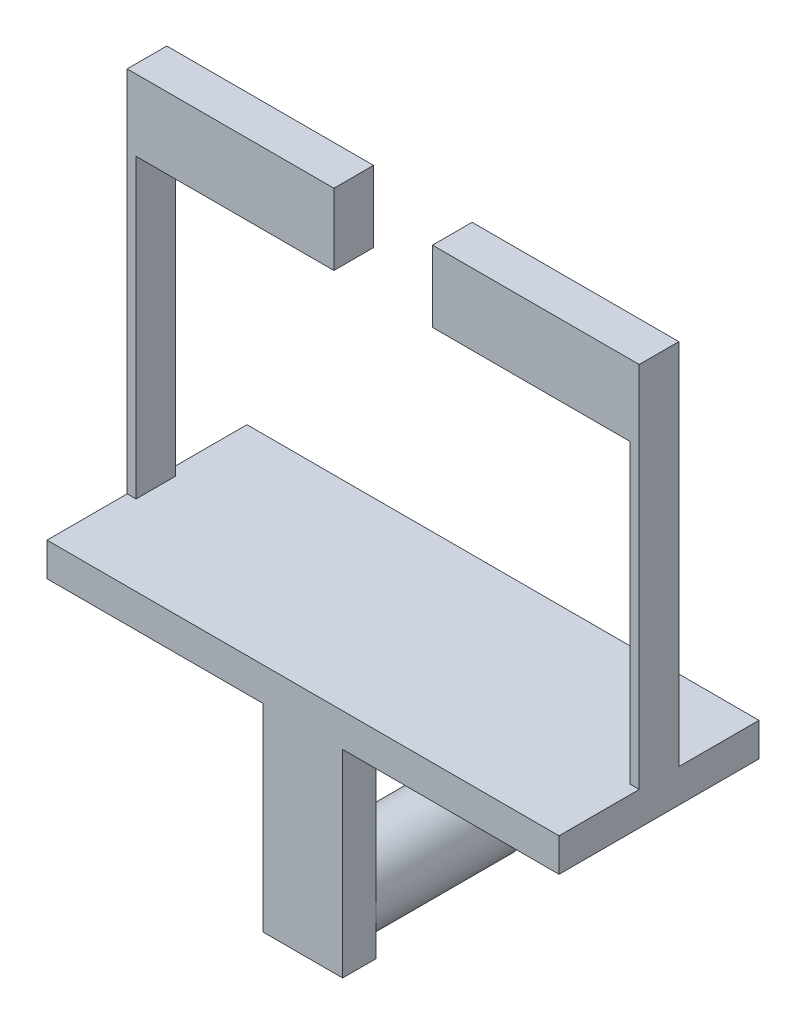
from build123d import *

# Parameters (mm, degrees)
SKETCH6_W            = 10.1981
SKETCH6_H            = 4.28752
BOSS_EXTRUDE3_DEPTH  = 25.4
SKETCH8_R            = 5.09905
BOSS_EXTRUDE5_DEPTH  = 19.05
SKETCH11_W           = 65.69456
SKETCH11_H           = 25.654
BOSS_EXTRUDE10_DEPTH = 4.28752
SKETCH16_W           = 1.143
SKETCH16_H           = 5.08
SKETCH16_W_2         = 1.155076163
BOSS_EXTRUDE11_DEPTH = 38.0746
SKETCH17_W           = 26.52268
SKETCH17_H           = 5.08
BOSS_EXTRUDE12_DEPTH = 9.144


with BuildPart() as part:
    # Sketch6 → Boss-Extrude3 (new body)
    with BuildSketch(Plane(origin=(0, 0, 0), x_dir=(1, 0, 0), z_dir=(0, 1, 0))):
        with Locations((-12.169797761, 9.77580804)):
            Rectangle(SKETCH6_W, SKETCH6_H)
    extrude(amount=BOSS_EXTRUDE3_DEPTH)

    # Sketch8 → Boss-Extrude5 (add)
    with BuildSketch(Plane.XY.offset(-11.91956804)):
        with Locations((-12.169797761, 5.098542)):
            Circle(SKETCH8_R)
    extrude(amount=-BOSS_EXTRUDE5_DEPTH)

    # Sketch11 → Boss-Extrude10 (add)
    with BuildSketch(Plane(origin=(0, 25.4, 0), x_dir=(1, 0, 0), z_dir=(0, 1, 0))):
        with Locations((-12.150747761, 20.45904804)):
            Rectangle(SKETCH11_W, SKETCH11_H)
    extrude(amount=BOSS_EXTRUDE10_DEPTH)

    # Sketch16 → Boss-Extrude11 (add)
    with BuildSketch(Plane(origin=(0, 29.68752, 0), x_dir=(1, 0, 0), z_dir=(0, 1, 0))):
        with Locations((-44.426527761, 20.45904804)):
            Rectangle(SKETCH16_W, SKETCH16_H)
        with Locations((20.118994158, 20.45904804)):
            Rectangle(SKETCH16_W_2, SKETCH16_H)
    extrude(amount=BOSS_EXTRUDE11_DEPTH)

    # Sketch17 → Boss-Extrude12 (add)
    with BuildSketch(Plane(origin=(0, 67.76212, 0), x_dir=(1, 0, 0), z_dir=(0, 1, 0))):
        with Locations((-31.736687761, 20.45904804)):
            Rectangle(SKETCH17_W, SKETCH17_H)
        with Locations((7.435192239, 20.45904804)):
            Rectangle(SKETCH17_W, SKETCH17_H)
    extrude(amount=BOSS_EXTRUDE12_DEPTH)


solid = part.part
